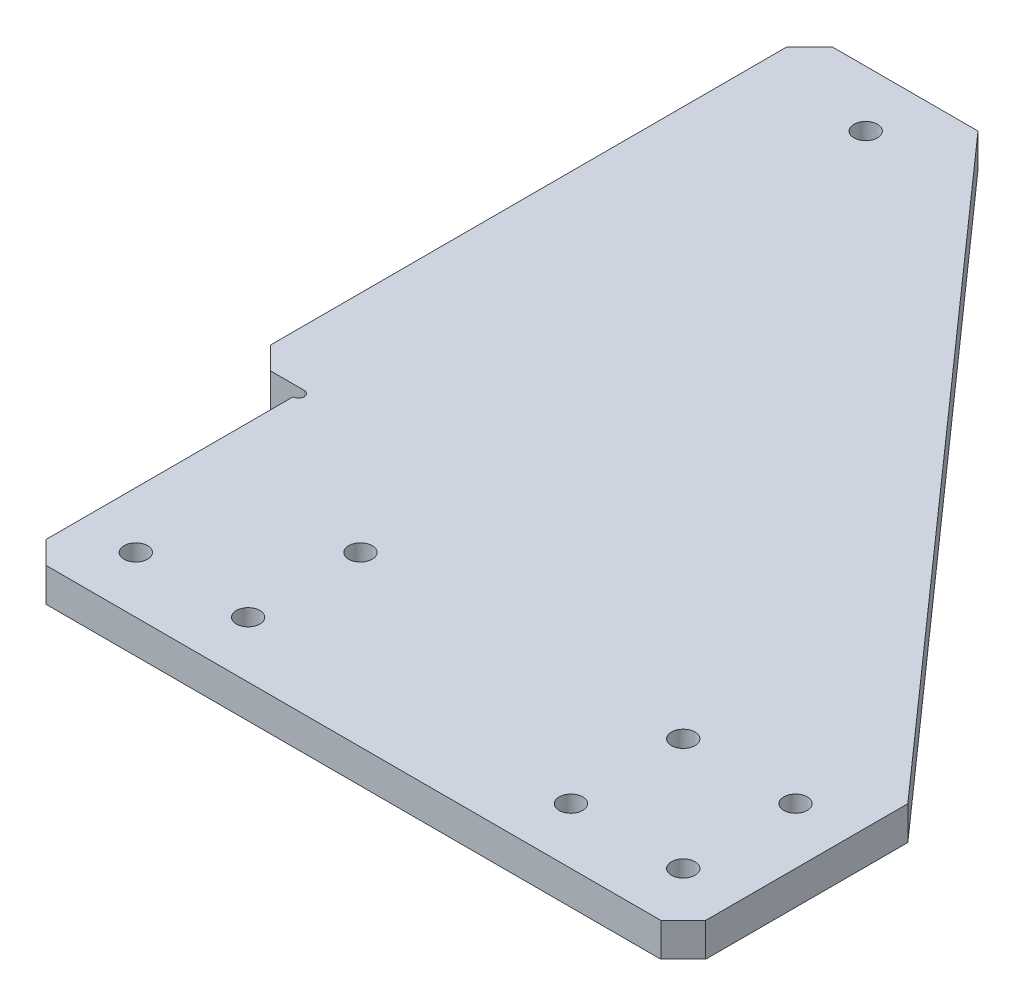
from build123d import *

# Parameters (mm, degrees)
SKETCH_1_R          = 2.1
EXTRUDE_1_DEPTH     = 3
SKETCH_2_R          = 1
CUT_EXTRUDE_1_DEPTH = 166.113786523
CHAMFER_1_SIZE      = 4
CHAMFER_2_SIZE      = 2


with BuildPart() as part:
    # 草图1 → 凸台-拉伸1 (new, symmetric)
    with BuildSketch(Plane(origin=(0, 0, 0), x_dir=(1, 0, 0), z_dir=(0, 1, 0))):
        Polygon((-68.75, 150), (-68.75, 50), (-58.75, 50), (-58.75, 0), (58.75, 0), (58.75, 40), (-38.75, 150), align=None)
        with Locations(Location((-48.75, 140, 0), (0, 0, 270))):
            Circle(SKETCH_1_R, mode=Mode.SUBTRACT)
        with Locations(Location((-48.75, 10, 0), (0, 0, 270))):
            Circle(SKETCH_1_R, mode=Mode.SUBTRACT)
        with Locations(Location((-28.75, 30, 0), (0, 0, 270))):
            Circle(SKETCH_1_R, mode=Mode.SUBTRACT)
        with Locations(Location((28.75, 30, 0), (0, 0, 270))):
            Circle(SKETCH_1_R, mode=Mode.SUBTRACT)
        with Locations(Location((-28.75, 10, 0), (0, 0, 270))):
            Circle(SKETCH_1_R, mode=Mode.SUBTRACT)
        with Locations(Location((28.75, 10, 0), (0, 0, 270))):
            Circle(SKETCH_1_R, mode=Mode.SUBTRACT)
        with Locations(Location((48.75, 30, 0), (0, 0, 270))):
            Circle(SKETCH_1_R, mode=Mode.SUBTRACT)
        with Locations(Location((48.75, 10, 0), (0, 0, 270))):
            Circle(SKETCH_1_R, mode=Mode.SUBTRACT)
    extrude(amount=EXTRUDE_1_DEPTH, both=True)

    # 草图2 → 切除-拉伸1 (cut, through all)
    with BuildSketch(Plane(origin=(0, 3, 0), x_dir=(1, 0, 0), z_dir=(0, 1, 0))):
        with Locations((-58.75, 49)):
            Circle(SKETCH_2_R)
    extrude(amount=-CUT_EXTRUDE_1_DEPTH, mode=Mode.SUBTRACT)

    # 倒角1
    chamfer_1_edges = [part.edges().sort_by_distance(p)[0] for p in [
        (58.75, 0, 0),
        (-58.75, 0, 0),
        (-68.75, 0, -50),
        (-68.75, 0, -150),
    ]]
    chamfer(chamfer_1_edges, length=CHAMFER_1_SIZE)

    # 倒角2
    chamfer_2_edges = [part.edges().sort_by_distance(p)[0] for p in [
        (-48.75, -3, -142.1),
        (-28.75, -3, -32.1),
        (-48.75, -3, -12.1),
        (28.75, -3, -32.1),
        (-28.75, -3, -12.1),
        (28.75, -3, -12.1),
        (48.75, -3, -12.1),
        (48.75, -3, -32.1),
    ]]
    chamfer(chamfer_2_edges, length=CHAMFER_2_SIZE)


solid = part.part
